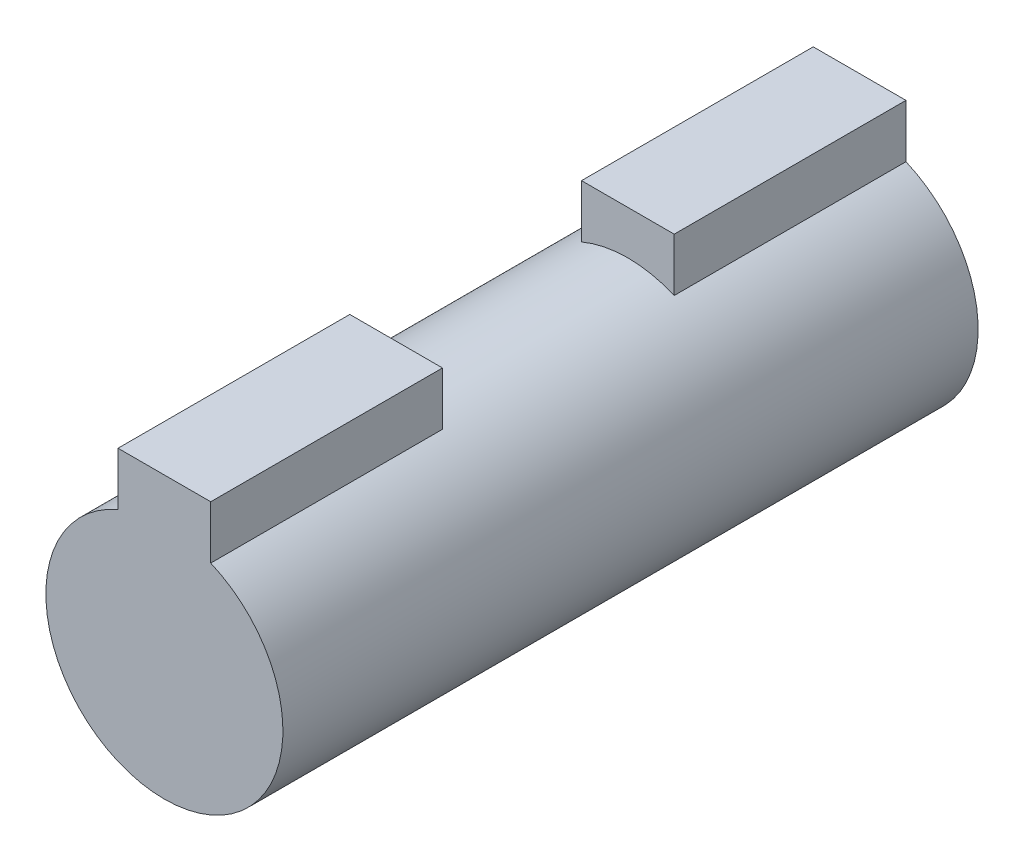
from build123d import *

# Parameters (mm, degrees)
BOSS_EXTRUDE1_DEPTH = 30
CUT_EXTRUDE1_START  = -20
SKETCH2_R           = 7.491127225
SKETCH2_R_2         = 5.1145
CUT_EXTRUDE1_DEPTH  = 10


with BuildPart() as part:
    # Sketch1 → Boss-Extrude1 (new body)
    with BuildSketch(Plane.XY):
        with BuildLine():
            Line((2, 7), (-2, 7))
            Line((-2, 7), (-2, 4.707240195))
            ThreePointArc((-2, 4.707240195), (0, -5.1145), (2, 4.707240195))
            Line((2, 4.707240195), (2, 7))
        make_face()
    extrude(amount=BOSS_EXTRUDE1_DEPTH)

    # Sketch2 → Cut-Extrude1 (cut)
    with BuildSketch(Plane.XY.offset(30).offset(CUT_EXTRUDE1_START)):
        Circle(SKETCH2_R)
        with Locations(Location((0, 0, 0), (0, 0, 113.01954222))):
            Circle(SKETCH2_R_2, mode=Mode.SUBTRACT)
    extrude(amount=CUT_EXTRUDE1_DEPTH, mode=Mode.SUBTRACT)


solid = part.part
